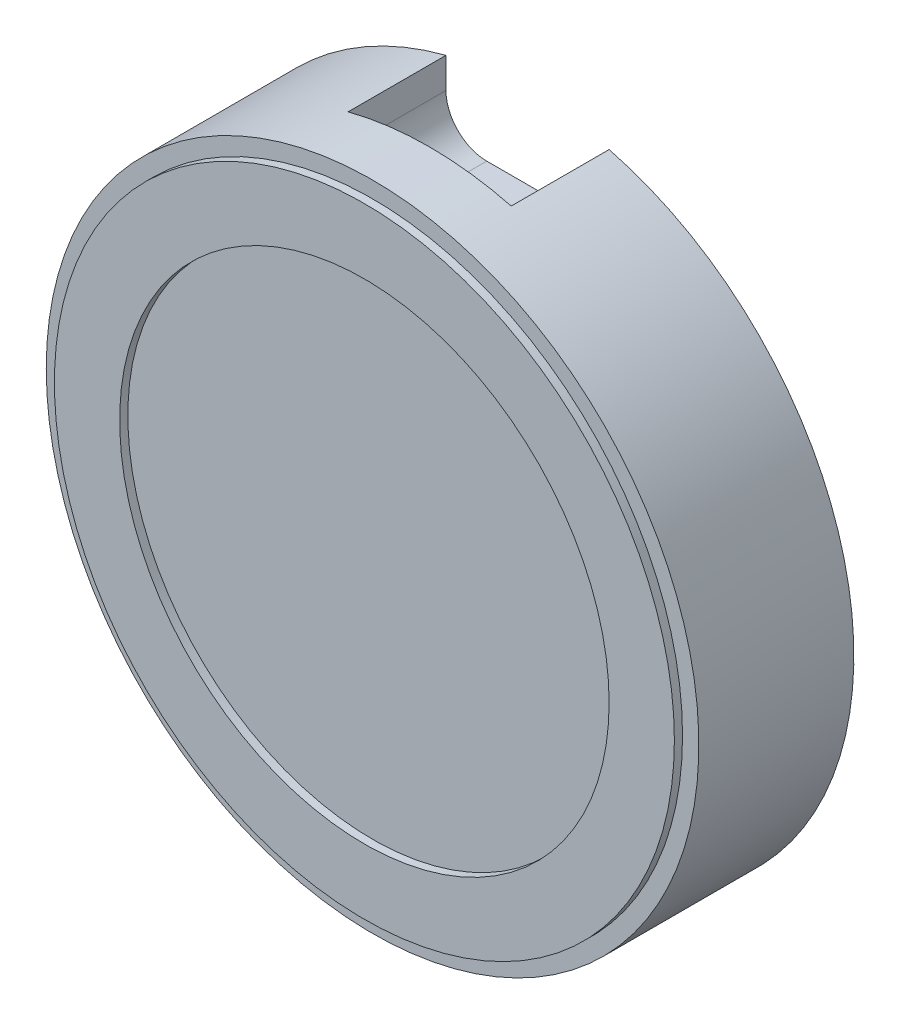
from build123d import *

# Parameters (mm, degrees)
SKETCH2_R                = 19
SKETCH2_R_2              = 15
BOSS_EXTRUDE1_DEPTH      = 0.5
SKETCH3_R                = 20
BOSS_EXTRUDE2_DEPTH      = 9.5
CUT_EXTRUDE2_START       = -6
CUT_EXTRUDE2_DEPTH       = 6
M3_CLEARANCE_HOLE1_D     = 3.4
M3_CLEARANCE_HOLE1_DEPTH = 5
M3_CLEARANCE_HOLE1_TIP   = 1.021463052


with BuildPart() as part:
    # Sketch2 → Boss-Extrude1 (new body)
    with BuildSketch(Plane(origin=(0, 0, 0), x_dir=(0, 1, 0), z_dir=(0, 0, 1))):
        with Locations(Location((0, 0, 0), (0, 0, 270))):
            Circle(SKETCH2_R)
        with Locations(Location((0, 0, 0), (0, 0, 270))):
            Circle(SKETCH2_R_2, mode=Mode.SUBTRACT)
    extrude(amount=-BOSS_EXTRUDE1_DEPTH)

    # Sketch3 → Boss-Extrude2 (add)
    with BuildSketch(Plane(origin=(0, 0, -0.5), x_dir=(1, 0, 0), z_dir=(0, 0, -1))):
        with Locations(Location((0, 0, 0), (0, 0, 180))):
            Circle(SKETCH3_R)
    extrude(amount=BOSS_EXTRUDE2_DEPTH)

    # Sketch4 → Cut-Extrude2 (cut)
    with BuildSketch(Plane(origin=(0, 0, -10), x_dir=(1, 0, 0), z_dir=(0, 0, -1)).offset(CUT_EXTRUDE2_START)):
        with BuildLine():
            Line((-5, -17.5), (-5, -19.364916731))
            ThreePointArc((-5, -19.364916731), (0, -20), (5, -19.364916731))
            Line((5, -19.364916731), (5, -17.5))
            ThreePointArc((5, -17.5), (4.267766953, -15.732233047), (2.5, -15))
            Line((2.5, -15), (-2.5, -15))
            ThreePointArc((-2.5, -15), (-4.267766953, -15.732233047), (-5, -17.5))
        make_face()
    extrude(amount=CUT_EXTRUDE2_DEPTH, mode=Mode.SUBTRACT)

    # M3 Clearance Hole1
    with Locations(Plane(origin=(0, 0, -10), x_dir=(1, 0, 0), z_dir=(0, 0, -1))):
        with Locations((-8.838834765, -8.838834765), (8.838834765, -8.838834765), (8.838834765, 8.838834765), (-8.838834765, 8.838834765)):
            Hole(M3_CLEARANCE_HOLE1_D / 2, depth=M3_CLEARANCE_HOLE1_DEPTH)
            with Locations((0, 0, -(M3_CLEARANCE_HOLE1_DEPTH + M3_CLEARANCE_HOLE1_TIP / 2))):  # 118° drill point
                Cone(0, M3_CLEARANCE_HOLE1_D / 2, M3_CLEARANCE_HOLE1_TIP, mode=Mode.SUBTRACT)


solid = part.part
